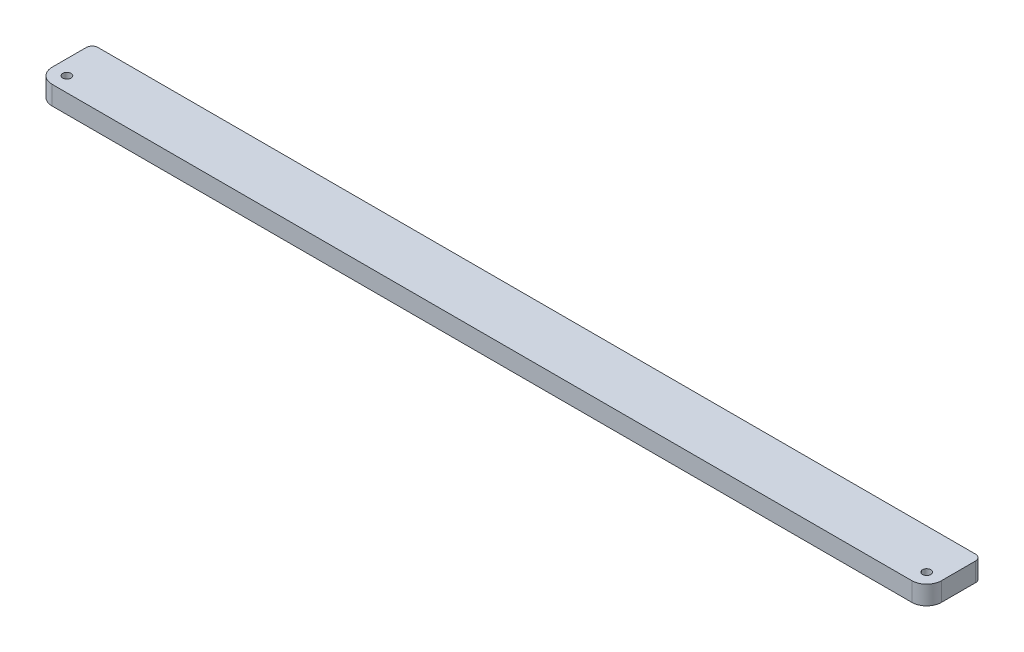
from build123d import *
from OCP.BRepFilletAPI import BRepFilletAPI_MakeFillet

# Parameters (mm, degrees)
SKETCH1_W           = 300
SKETCH1_H           = 18.5
BOSS_EXTRUDE1_DEPTH = 6.35
FILLET1_R1          = 5
FILLET1_R2          = 2
SKETCH2_R           = 1.4
CUT_EXTRUDE1_DEPTH  = 151.419031376


with BuildPart() as part:
    # Sketch1 → Boss-Extrude1 (new body)
    with BuildSketch(Plane(origin=(0, 0, 0), x_dir=(1, 0, 0), z_dir=(0, 1, 0))):
        Rectangle(SKETCH1_W, SKETCH1_H)
    extrude(amount=BOSS_EXTRUDE1_DEPTH)

    # Fillet1: one fillet with a radius per group of edges: ONE call of the kernel's fillet builder (fillet() takes one radius for all edges)
    fillet1_edges_1 = [part.edges().sort_by_distance(p)[0] for p in [
        (-150, 3.175, 9.25),
        (150, 3.175, 9.25),
    ]]
    fillet1_edges_2 = [part.edges().sort_by_distance(p)[0] for p in [
        (-150, 3.175, -9.25),
        (150, 3.175, -9.25),
    ]]
    fillet1 = BRepFilletAPI_MakeFillet(part.part.solid().wrapped)
    for e in fillet1_edges_1:
        fillet1.Add(FILLET1_R1, e.wrapped)
    for e in fillet1_edges_2:
        fillet1.Add(FILLET1_R2, e.wrapped)
    add(Compound.cast(fillet1.Shape()), mode=Mode.REPLACE)

    # Sketch2 → Cut-Extrude1 (cut, through all)
    with BuildSketch(Plane(origin=(0, 6.35, 0), x_dir=(1, 0, 0), z_dir=(0, 1, 0))):
        with Locations((-145, -4.25)):
            Circle(SKETCH2_R)
        with Locations((145, -4.25)):
            Circle(SKETCH2_R)
    extrude(amount=-CUT_EXTRUDE1_DEPTH, mode=Mode.SUBTRACT)


solid = part.part
